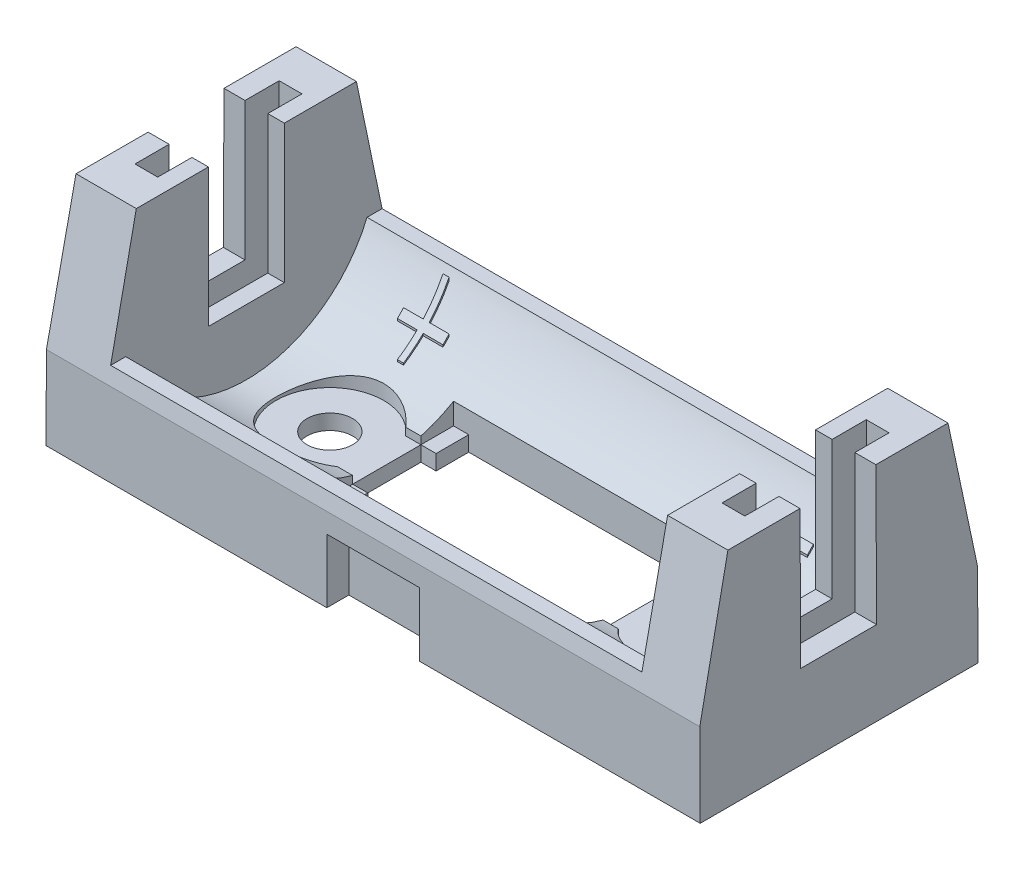
from build123d import *

# Parameters (mm, degrees)
EXTRUDE1_DEPTH          = 21.55
EXTRUDE10_DEPTH         = 12.7
CUT_EXTRUDE2_DEPTH      = 17.5
CUT_EXTRUDE2_DEPTH_BACK = 17.5
CUT_EXTRUDE3_DEPTH      = 17.5
SKETCH16_W              = 6.097167606
SKETCH16_H              = 1.45
CUT_EXTRUDE4_DEPTH      = 4.2
SKETCH17_R              = 0.65
BOSS_EXTRUDE1_DEPTH     = 2
CUT_EXTRUDE6_DEPTH      = 28.591393586
BOSS_EXTRUDE2_DEPTH     = 1
SKETCH20_W              = 1
SKETCH20_H              = 2.15
BOSS_EXTRUDE2_2_DEPTH   = 1
BOSS_EXTRUDE2_3_DEPTH   = 1
BOSS_EXTRUDE2_4_DEPTH   = 1
SKETCH22_R              = 1.5
CUT_EXTRUDE7_DEPTH      = 28.591393586
SKETCH23_W              = 1.3
SKETCH23_H              = 0.4
SKETCH23_W_2            = 0.4
SKETCH23_H_2            = 1.3
SKETCH23_W_3            = 3
BOSS_EXTRUDE3_DEPTH     = 14.6
CUT_EXTRUDE8_START      = 4
SKETCH24_R              = 8.5125
CUT_EXTRUDE8_DEPTH      = 27
SKETCH25_W              = 1.5
SKETCH25_H              = 9.5
CUT_EXTRUDE9_DEPTH      = 13
SKETCH26_W              = 0.2
SKETCH26_H              = 1
CUT_EXTRUDE10_DEPTH     = 1.6


with BuildPart() as part:
    # Sketch1 → Extrude1 (new, symmetric)
    with BuildSketch(Plane(origin=(0, 0, 0), x_dir=(0, 0, -1), z_dir=(1, 0, 0))):
        Polygon((-9.15, 5.5), (-7.25, 14.6), (-2.5, 14.6), (-2.5, 5.5), (2.5, 5.5), (2.5, 14.6), (7.25, 14.6), (9.15, 5.5), (9.15, 0), (-9.15, 0), align=None)
    extrude(amount=EXTRUDE1_DEPTH, both=True)

    # Sketch11 → Extrude10 (cut, symmetric)
    with BuildSketch(Plane.XY):
        Polygon((-21.55, 14.6), (-21.55, 0), (-21.47355388, 14.6), align=None)
        Polygon((21.47355388, 14.6), (21.55, 14.6), (21.55, 0), align=None)
    extrude(amount=EXTRUDE10_DEPTH, both=True, mode=Mode.SUBTRACT)

    # Sketch14 → Cut-Extrude2 (cut, two sides: drawn at the far end of the back side and taken through both)
    with BuildSketch(Plane(origin=(0, 0, 0), x_dir=(0, 0, -1), z_dir=(1, 0, 0)).offset(-CUT_EXTRUDE2_DEPTH_BACK)):
        with BuildLine():
            Line((-9.25, 6.5), (-7.95, 6.5))
            ThreePointArc((-7.95, 6.5), (0, 1.2), (7.95, 6.5))
            Line((7.95, 6.5), (9.25, 6.5))
            Line((9.25, 6.5), (9.25, 17.665807692))
            Line((9.25, 17.665807692), (-9.25, 17.665807692))
            Line((-9.25, 17.665807692), (-9.25, 6.5))
        make_face()
    extrude(amount=CUT_EXTRUDE2_DEPTH + CUT_EXTRUDE2_DEPTH_BACK, mode=Mode.SUBTRACT)

    # Sketch15 → Cut-Extrude3 (cut)
    with BuildSketch(Plane.XZ):
        Polygon((-9.25, 2), (-9.25, -2), (-8.25, -2), (-8.25, -4.4), (8.25, -4.4), (8.25, 4.4), (-8.25, 4.4), (-8.25, 2), align=None)
    extrude(amount=-CUT_EXTRUDE3_DEPTH, mode=Mode.SUBTRACT)

    # Sketch16 → Cut-Extrude4 (cut)
    with BuildSketch(Plane.XZ):
        with Locations((0, 8.425)):
            Rectangle(SKETCH16_W, SKETCH16_H)
        with Locations((0, -8.425)):
            Rectangle(SKETCH16_W, SKETCH16_H)
    extrude(amount=-CUT_EXTRUDE4_DEPTH, mode=Mode.SUBTRACT)

    # Sketch17 → Boss-Extrude1 (add)
    with BuildSketch(Plane.XZ):
        with Locations(Location((-19, -8.2, 0), (0, 0, 90))):
            Circle(SKETCH17_R)
    extrude(amount=BOSS_EXTRUDE1_DEPTH)

    # Sketch18 → Cut-Extrude6 (cut, through all)
    with BuildSketch(Plane.XZ):
        with BuildLine():
            Line((8.25, 2.25), (8.25, -2.25))
            Line((8.25, -2.25), (9.25, -2.25))
            ThreePointArc((9.25, -2.25), (15.553167601, 0), (9.25, 2.25))
            Line((9.25, 2.25), (8.25, 2.25))
        make_face()
        with BuildLine():
            Line((-9.25, -2.25), (-8.25, -2.25))
            Line((-8.25, -2.25), (-8.25, -2))
            Line((-8.25, -2), (-9.25, -2))
            Line((-9.25, -2), (-9.25, 2))
            Line((-9.25, 2), (-8.25, 2))
            Line((-8.25, 2), (-8.25, 2.25))
            Line((-8.25, 2.25), (-9.25, 2.25))
            ThreePointArc((-9.25, 2.25), (-15.553167601, 0), (-9.25, -2.25))
        make_face()
    extrude(amount=-CUT_EXTRUDE6_DEPTH, mode=Mode.SUBTRACT)

    # Sketch23 → Boss-Extrude3 (add, through all)
    with BuildSketch(Plane.XZ):
        with Locations((-11.15, -6.152737687)):
            Rectangle(SKETCH23_W, SKETCH23_H)
        with Locations((-12.85, -6.152737687)):
            Rectangle(SKETCH23_W, SKETCH23_H)
        with Locations((-12, -5.302737687)):
            Rectangle(SKETCH23_W_2, SKETCH23_H_2)
        with Locations((-12, -6.152737687)):
            Rectangle(SKETCH23_W_2, SKETCH23_H)
        with Locations((-12, -7.002737687)):
            Rectangle(SKETCH23_W_2, SKETCH23_H_2)
        with Locations((-12, 4.997262313)):
            Rectangle(SKETCH23_W_2, SKETCH23_H_2)
        with Locations((-12, 5.847262313)):
            Rectangle(SKETCH23_W_2, SKETCH23_H)
        with Locations((-11.15, 5.847262313)):
            Rectangle(SKETCH23_W, SKETCH23_H)
        with Locations((-12.85, 5.847262313)):
            Rectangle(SKETCH23_W, SKETCH23_H)
        with Locations((-12, 6.697262313)):
            Rectangle(SKETCH23_W_2, SKETCH23_H_2)
        with Locations((12, 5.847262313)):
            Rectangle(SKETCH23_W_3, SKETCH23_H)
        with Locations((12, -6.152737687)):
            Rectangle(SKETCH23_W_3, SKETCH23_H)
    extrude(amount=-BOSS_EXTRUDE3_DEPTH)

    # Sketch24 → Cut-Extrude8 (cut)
    with BuildSketch(Plane(origin=(-17.5, 0, 0), x_dir=(0, 0, -1), z_dir=(1, 0, 0)).offset(CUT_EXTRUDE8_START)):
        with Locations((0, 9.8125)):
            Circle(SKETCH24_R)
    extrude(amount=CUT_EXTRUDE8_DEPTH, mode=Mode.SUBTRACT)


with BuildPart() as body_2:
    # Sketch20 → Boss-Extrude2 (new body)
    with BuildSketch(Plane.XZ):
        with BuildLine():
            Line((-8.25, 2.25), (-9.25, 2.25))
            ThreePointArc((-9.25, 2.25), (-15.553167601, 0), (-9.25, -2.25))
            Line((-9.25, -2.25), (-8.25, -2.25))
            Line((-8.25, -2.25), (-8.25, 2.25))
        make_face()
    extrude(amount=-BOSS_EXTRUDE2_DEPTH)


with BuildPart() as body_3:
    # Sketch20 → Boss-Extrude2 2 (new body)
    with BuildSketch(Plane.XZ):
        with Locations((-7.75, 3.325)):
            Rectangle(SKETCH20_W, SKETCH20_H)
    extrude(amount=-BOSS_EXTRUDE2_2_DEPTH)


with BuildPart() as body_4:
    # Sketch20 → Boss-Extrude2 3 (new body)
    with BuildSketch(Plane.XZ):
        with Locations((-7.75, -3.325)):
            Rectangle(SKETCH20_W, SKETCH20_H)
    extrude(amount=-BOSS_EXTRUDE2_3_DEPTH)


with BuildPart() as body_5:
    # Sketch20 → Boss-Extrude2 4 (new body)
    with BuildSketch(Plane.XZ):
        with BuildLine():
            Line((9.25, 2.25), (8.25, 2.25))
            Line((8.25, 2.25), (8.25, -2.25))
            Line((8.25, -2.25), (9.25, -2.25))
            ThreePointArc((9.25, -2.25), (15.553167601, 0), (9.25, 2.25))
        make_face()
    extrude(amount=-BOSS_EXTRUDE2_4_DEPTH)


with BuildPart() as cut_extrude7_tool:
    # Sketch22 → Cut-Extrude7 (new, through all)
    with BuildSketch(Plane.XZ):
        with Locations(Location((-12, 0, 0), (0, 0, 270))):
            Circle(SKETCH22_R)
        with Locations(Location((12, 0, 0), (0, 0, 270))):
            Circle(SKETCH22_R)
    extrude(amount=-CUT_EXTRUDE7_DEPTH)


with BuildPart() as body_2_1:
    add(body_2.part)

    # Cut-Extrude7: cut by cut_extrude7_tool
    add(cut_extrude7_tool.part, mode=Mode.SUBTRACT)


with BuildPart() as body_5_1:
    add(body_5.part)

    # Cut-Extrude7: cut by cut_extrude7_tool
    add(cut_extrude7_tool.part, mode=Mode.SUBTRACT)


with BuildPart() as cut_extrude8_kept_piece:
    # of the separate pieces the step leaves, the one the design keeps (cut_extrude8_pieces_kept)
    add(part.part.solids().sort_by_distance((-21.521201804, 5.5, 9.15))[0])

    # Sketch25 → Cut-Extrude9 (cut)
    with BuildSketch(Plane(origin=(0, 14.6, 0), x_dir=(1, 0, 0), z_dir=(0, 1, 0))):
        with Locations((-19.338085679, 0)):
            Rectangle(SKETCH25_W, SKETCH25_H)
    cut_extrude9 = extrude(amount=-CUT_EXTRUDE9_DEPTH, mode=Mode.SUBTRACT)

    # Sketch26 → Cut-Extrude10 (cut)
    with BuildSketch(Plane(origin=(0, 1.6, 0), x_dir=(1, 0, 0), z_dir=(0, 1, 0))):
        with Locations((-19, 0)):
            Rectangle(SKETCH26_W, SKETCH26_H)
    cut_extrude10 = extrude(amount=-CUT_EXTRUDE10_DEPTH, mode=Mode.SUBTRACT)

    # Mirror1: Cut-Extrude9, Cut-Extrude10 across plane
    add(cut_extrude9.mirror(Plane(origin=(0, 0, 0), x_dir=(0, 0, 1), z_dir=(1, 0, 0))), mode=Mode.SUBTRACT)
    add(cut_extrude10.mirror(Plane(origin=(0, 0, 0), x_dir=(0, 0, 1), z_dir=(1, 0, 0))), mode=Mode.SUBTRACT)


solid = Compound([body_3.part, body_4.part, body_2_1.part, body_5_1.part, cut_extrude8_kept_piece.part])
